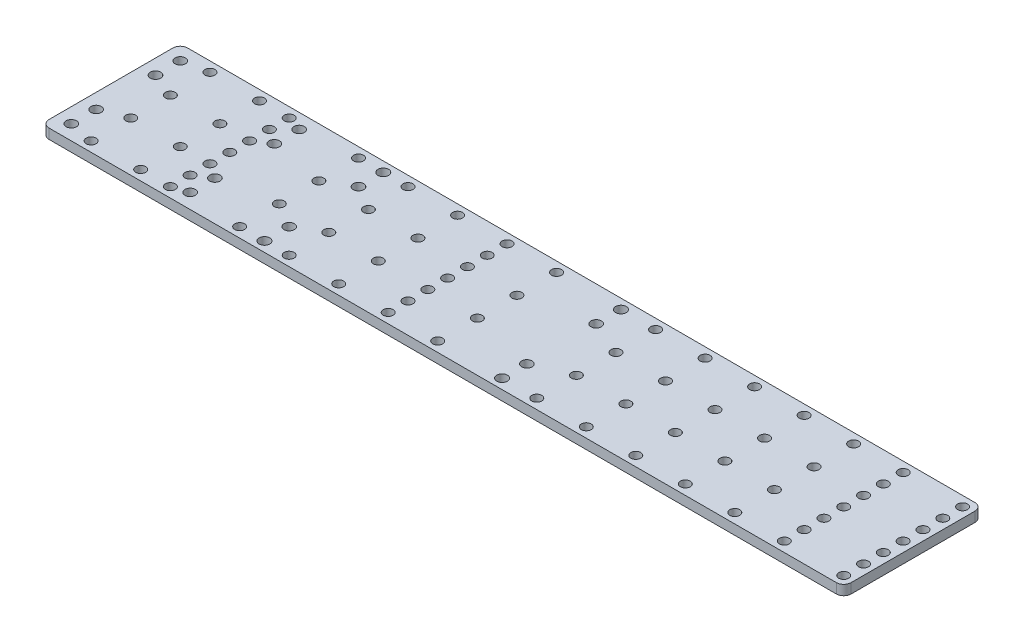
from build123d import *

# Parameters (mm, degrees)
SKETCH_1_W               = 324
SKETCH_1_H               = 56
EXTRUDE_1_DEPTH          = 4
CUT_EXTRUDE_1_DEPTH      = 10
CUT_EXTRUDE_2_DEPTH      = 329.828222633
CUT_EXTRUDE_2_DEPTH_BACK = 329.828222633
SKETCH_3_R               = 2.15
SKETCH_3_R_2             = 2.1
CUT_EXTRUDE_3_DEPTH      = 329.828222633
CUT_EXTRUDE_3_DEPTH_BACK = 329.828222633
SKETCH_4_R               = 2
FILLET_1_R               = 3


with BuildPart() as part:
    # 草图1 → 凸台-拉伸1 (new body)
    with BuildSketch(Plane(origin=(0, 0, 0), x_dir=(1, 0, 0), z_dir=(0, 1, 0))):
        with Locations((162, 28)):
            Rectangle(SKETCH_1_W, SKETCH_1_H)
    extrude(amount=EXTRUDE_1_DEPTH)

    # 草图2 → 切除-拉伸1 (cut)
    with BuildSketch(Plane(origin=(0, 4, 0), x_dir=(1, 0, 0), z_dir=(0, 1, 0))):
        with BuildLine():
            ThreePointArc((294, 44.000014101), (296, 42.000014101), (298, 44.000014101))
            ThreePointArc((298, 44.000014101), (296, 46.000014101), (294, 44.000014101))
        make_face()
        with BuildLine():
            ThreePointArc((294, 52.000014101), (296, 50.000014101), (298, 52.000014101))
            ThreePointArc((298, 52.000014101), (296, 54.000014101), (294, 52.000014101))
        make_face()
        with BuildLine():
            ThreePointArc((294, 12.000014101), (296, 10.000014101), (298, 12.000014101))
            ThreePointArc((298, 12.000014101), (296, 14.000014101), (294, 12.000014101))
        make_face()
        with BuildLine():
            ThreePointArc((294, 4.000014101), (296, 2.000014101), (298, 4.000014101))
            ThreePointArc((298, 4.000014101), (296, 6.000014101), (294, 4.000014101))
        make_face()
        with BuildLine():
            ThreePointArc((294, 20.000014101), (296, 18.000014101), (298, 20.000014101))
            ThreePointArc((298, 20.000014101), (296, 22.000014101), (294, 20.000014101))
        make_face()
        with BuildLine():
            ThreePointArc((294, 28.000014101), (296, 26.000014101), (298, 28.000014101))
            ThreePointArc((298, 28.000014101), (296, 30.000014101), (294, 28.000014101))
        make_face()
        with BuildLine():
            ThreePointArc((294, 36.000014101), (296, 34.000014101), (298, 36.000014101))
            ThreePointArc((298, 36.000014101), (296, 38.000014101), (294, 36.000014101))
        make_face()
        with BuildLine():
            ThreePointArc((134, 44.000014101), (136, 42.000014101), (138, 44.000014101))
            ThreePointArc((138, 44.000014101), (136, 46.000014101), (134, 44.000014101))
        make_face()
        with BuildLine():
            ThreePointArc((134, 52.000014101), (136, 50.000014101), (138, 52.000014101))
            ThreePointArc((138, 52.000014101), (136, 54.000014101), (134, 52.000014101))
        make_face()
        with BuildLine():
            ThreePointArc((134, 12.000014101), (136, 10.000014101), (138, 12.000014101))
            ThreePointArc((138, 12.000014101), (136, 14.000014101), (134, 12.000014101))
        make_face()
        with BuildLine():
            ThreePointArc((134, 4.000014101), (136, 2.000014101), (138, 4.000014101))
            ThreePointArc((138, 4.000014101), (136, 6.000014101), (134, 4.000014101))
        make_face()
        with BuildLine():
            ThreePointArc((134, 20.000014101), (136, 18.000014101), (138, 20.000014101))
            ThreePointArc((138, 20.000014101), (136, 22.000014101), (134, 20.000014101))
        make_face()
        with BuildLine():
            ThreePointArc((134, 28.000014101), (136, 26.000014101), (138, 28.000014101))
            ThreePointArc((138, 28.000014101), (136, 30.000014101), (134, 28.000014101))
        make_face()
        with BuildLine():
            ThreePointArc((134, 36.000014101), (136, 34.000014101), (138, 36.000014101))
            ThreePointArc((138, 36.000014101), (136, 38.000014101), (134, 36.000014101))
        make_face()
        with BuildLine():
            ThreePointArc((46, 44.000014101), (48, 42.000014101), (50, 44.000014101))
            ThreePointArc((50, 44.000014101), (48, 46.000014101), (46, 44.000014101))
        make_face()
        with BuildLine():
            ThreePointArc((46, 52.000014101), (48, 50.000014101), (50, 52.000014101))
            ThreePointArc((50, 52.000014101), (48, 54.000014101), (46, 52.000014101))
        make_face()
        with BuildLine():
            ThreePointArc((46, 12.000014101), (48, 10.000014101), (50, 12.000014101))
            ThreePointArc((50, 12.000014101), (48, 14.000014101), (46, 12.000014101))
        make_face()
        with BuildLine():
            ThreePointArc((46, 4.000014101), (48, 2.000014101), (50, 4.000014101))
            ThreePointArc((50, 4.000014101), (48, 6.000014101), (46, 4.000014101))
        make_face()
        with BuildLine():
            ThreePointArc((46, 20.000014101), (48, 18.000014101), (50, 20.000014101))
            ThreePointArc((50, 20.000014101), (48, 22.000014101), (46, 20.000014101))
        make_face()
        with BuildLine():
            ThreePointArc((46, 28.000014101), (48, 26.000014101), (50, 28.000014101))
            ThreePointArc((50, 28.000014101), (48, 30.000014101), (46, 28.000014101))
        make_face()
        with BuildLine():
            ThreePointArc((46, 36.000014101), (48, 34.000014101), (50, 36.000014101))
            ThreePointArc((50, 36.000014101), (48, 38.000014101), (46, 36.000014101))
        make_face()
    extrude(amount=-CUT_EXTRUDE_1_DEPTH, mode=Mode.SUBTRACT)

    # 草图3 → 切除-拉伸2 (cut, two sides: drawn at the far end of the back side and taken through both)
    with BuildSketch(Plane(origin=(0, 4, 0), x_dir=(1, 0, 0), z_dir=(0, 1, 0)).offset(-CUT_EXTRUDE_2_DEPTH_BACK)):
        with Locations(Location((182, 52, 0), (0, 0, 270))):
            Circle(SKETCH_3_R)
        with Locations(Location((182, 42, 0), (0, 0, 270))):
            Circle(SKETCH_3_R_2)
        with Locations(Location((182, 14, 0), (0, 0, 270))):
            Circle(SKETCH_3_R_2)
        with Locations(Location((182, 4, 0), (0, 0, 270))):
            Circle(SKETCH_3_R)
        with Locations(Location((86, 52, 0), (0, 0, 270))):
            Circle(SKETCH_3_R)
        with Locations(Location((86, 4, 0), (0, 0, 270))):
            Circle(SKETCH_3_R)
        with Locations(Location((86, 42, 0), (0, 0, 270))):
            Circle(SKETCH_3_R_2)
        with Locations(Location((86, 14, 0), (0, 0, 270))):
            Circle(SKETCH_3_R_2)
        with Locations(Location((6, 6, 0), (0, 0, 270))):
            Circle(SKETCH_3_R_2)
        with Locations(Location((6, 16, 0), (0, 0, 270))):
            Circle(SKETCH_3_R_2)
        with Locations(Location((6, 40, 0), (0, 0, 270))):
            Circle(SKETCH_3_R_2)
        with Locations(Location((6, 50, 0), (0, 0, 270))):
            Circle(SKETCH_3_R_2)
        with Locations(Location((54, 50, 0), (0, 0, 270))):
            Circle(SKETCH_3_R_2)
        with Locations(Location((54, 40, 0), (0, 0, 270))):
            Circle(SKETCH_3_R_2)
        with Locations(Location((54, 6, 0), (0, 0, 270))):
            Circle(SKETCH_3_R_2)
        with Locations(Location((54, 16, 0), (0, 0, 270))):
            Circle(SKETCH_3_R_2)
    extrude(amount=CUT_EXTRUDE_2_DEPTH + CUT_EXTRUDE_2_DEPTH_BACK, mode=Mode.SUBTRACT)

    # 草图4 → 切除-拉伸3 (cut, two sides: drawn at the far end of the back side and taken through both)
    with BuildSketch(Plane(origin=(0, 4, 0), x_dir=(1, 0, 0), z_dir=(0, 1, 0)).offset(-CUT_EXTRUDE_3_DEPTH_BACK)):
        with Locations(Location((296, 4.000014101, 0), (0, 0, 270))):
            Circle(SKETCH_4_R)
        with Locations(Location((296, 20.000014101, 0), (0, 0, 270))):
            Circle(SKETCH_4_R)
        with Locations(Location((296, 36.000014101, 0), (0, 0, 270))):
            Circle(SKETCH_4_R)
        with Locations(Location((296, 52.000014101, 0), (0, 0, 270))):
            Circle(SKETCH_4_R)
        with Locations(Location((276, 4.000014101, 0), (0, 0, 270))):
            Circle(SKETCH_4_R)
        with Locations(Location((276, 20.000014101, 0), (0, 0, 270))):
            Circle(SKETCH_4_R)
        with Locations(Location((276, 36.000014101, 0), (0, 0, 270))):
            Circle(SKETCH_4_R)
        with Locations(Location((276, 52.000014101, 0), (0, 0, 270))):
            Circle(SKETCH_4_R)
        with Locations(Location((256, 4.000014101, 0), (0, 0, 270))):
            Circle(SKETCH_4_R)
        with Locations(Location((256, 20.000014101, 0), (0, 0, 270))):
            Circle(SKETCH_4_R)
        with Locations(Location((256, 36.000014101, 0), (0, 0, 270))):
            Circle(SKETCH_4_R)
        with Locations(Location((256, 52.000014101, 0), (0, 0, 270))):
            Circle(SKETCH_4_R)
        with Locations(Location((236, 4.000014101, 0), (0, 0, 270))):
            Circle(SKETCH_4_R)
        with Locations(Location((236, 20.000014101, 0), (0, 0, 270))):
            Circle(SKETCH_4_R)
        with Locations(Location((236, 36.000014101, 0), (0, 0, 270))):
            Circle(SKETCH_4_R)
        with Locations(Location((236, 52.000014101, 0), (0, 0, 270))):
            Circle(SKETCH_4_R)
        with Locations(Location((216, 4.000014101, 0), (0, 0, 270))):
            Circle(SKETCH_4_R)
        with Locations(Location((216, 20.000014101, 0), (0, 0, 270))):
            Circle(SKETCH_4_R)
        with Locations(Location((216, 36.000014101, 0), (0, 0, 270))):
            Circle(SKETCH_4_R)
        with Locations(Location((216, 52.000014101, 0), (0, 0, 270))):
            Circle(SKETCH_4_R)
        with Locations(Location((196, 4.000014101, 0), (0, 0, 270))):
            Circle(SKETCH_4_R)
        with Locations(Location((196, 20.000014101, 0), (0, 0, 270))):
            Circle(SKETCH_4_R)
        with Locations(Location((196, 36.000014101, 0), (0, 0, 270))):
            Circle(SKETCH_4_R)
        with Locations(Location((196, 52.000014101, 0), (0, 0, 270))):
            Circle(SKETCH_4_R)
        with Locations(Location((156, 4.000014101, 0), (0, 0, 270))):
            Circle(SKETCH_4_R)
        with Locations(Location((156, 20.000014101, 0), (0, 0, 270))):
            Circle(SKETCH_4_R)
        with Locations(Location((156, 36.000014101, 0), (0, 0, 270))):
            Circle(SKETCH_4_R)
        with Locations(Location((156, 52.000014101, 0), (0, 0, 270))):
            Circle(SKETCH_4_R)
        with Locations(Location((116, 4.000014101, 0), (0, 0, 270))):
            Circle(SKETCH_4_R)
        with Locations(Location((116, 20.000014101, 0), (0, 0, 270))):
            Circle(SKETCH_4_R)
        with Locations(Location((116, 36.000014101, 0), (0, 0, 270))):
            Circle(SKETCH_4_R)
        with Locations(Location((116, 52.000014101, 0), (0, 0, 270))):
            Circle(SKETCH_4_R)
        with Locations(Location((96, 4.000014101, 0), (0, 0, 270))):
            Circle(SKETCH_4_R)
        with Locations(Location((96, 20.000014101, 0), (0, 0, 270))):
            Circle(SKETCH_4_R)
        with Locations(Location((96, 36.000014101, 0), (0, 0, 270))):
            Circle(SKETCH_4_R)
        with Locations(Location((96, 52.000014101, 0), (0, 0, 270))):
            Circle(SKETCH_4_R)
        with Locations(Location((76, 4.000014101, 0), (0, 0, 270))):
            Circle(SKETCH_4_R)
        with Locations(Location((76, 20.000014101, 0), (0, 0, 270))):
            Circle(SKETCH_4_R)
        with Locations(Location((76, 36.000014101, 0), (0, 0, 270))):
            Circle(SKETCH_4_R)
        with Locations(Location((76, 52.000014101, 0), (0, 0, 270))):
            Circle(SKETCH_4_R)
        with Locations(Location((36, 4.000014101, 0), (0, 0, 270))):
            Circle(SKETCH_4_R)
        with Locations(Location((36, 20.000014101, 0), (0, 0, 270))):
            Circle(SKETCH_4_R)
        with Locations(Location((36, 36.000014101, 0), (0, 0, 270))):
            Circle(SKETCH_4_R)
        with Locations(Location((36, 52.000014101, 0), (0, 0, 270))):
            Circle(SKETCH_4_R)
        with Locations(Location((16, 4.000014101, 0), (0, 0, 270))):
            Circle(SKETCH_4_R)
        with Locations(Location((16, 20.000014101, 0), (0, 0, 270))):
            Circle(SKETCH_4_R)
        with Locations(Location((16, 36.000014101, 0), (0, 0, 270))):
            Circle(SKETCH_4_R)
        with Locations(Location((16, 52.000014101, 0), (0, 0, 270))):
            Circle(SKETCH_4_R)
        with BuildLine():
            ThreePointArc((318, 44.000014101), (320, 42.000014101), (322, 44.000014101))
            ThreePointArc((322, 44.000014101), (320, 46.000014101), (318, 44.000014101))
        make_face()
        with BuildLine():
            ThreePointArc((318, 52.000014101), (320, 50.000014101), (322, 52.000014101))
            ThreePointArc((322, 52.000014101), (320, 54.000014101), (318, 52.000014101))
        make_face()
        with BuildLine():
            ThreePointArc((318, 12.000014101), (320, 10.000014101), (322, 12.000014101))
            ThreePointArc((322, 12.000014101), (320, 14.000014101), (318, 12.000014101))
        make_face()
        with BuildLine():
            ThreePointArc((318, 4.000014101), (320, 2.000014101), (322, 4.000014101))
            ThreePointArc((322, 4.000014101), (320, 6.000014101), (318, 4.000014101))
        make_face()
        with BuildLine():
            ThreePointArc((318, 20.000014101), (320, 18.000014101), (322, 20.000014101))
            ThreePointArc((322, 20.000014101), (320, 22.000014101), (318, 20.000014101))
        make_face()
        with BuildLine():
            ThreePointArc((318, 28.000014101), (320, 26.000014101), (322, 28.000014101))
            ThreePointArc((322, 28.000014101), (320, 30.000014101), (318, 28.000014101))
        make_face()
        with BuildLine():
            ThreePointArc((318, 36.000014101), (320, 34.000014101), (322, 36.000014101))
            ThreePointArc((322, 36.000014101), (320, 38.000014101), (318, 36.000014101))
        make_face()
    extrude(amount=CUT_EXTRUDE_3_DEPTH + CUT_EXTRUDE_3_DEPTH_BACK, mode=Mode.SUBTRACT)

    # 圆角1
    fillet_1_edges = [part.edges().sort_by_distance(p)[0] for p in [
        (0, 2, -56),
        (324, 2, -56),
        (324, 2, 0),
        (0, 2, 0),
    ]]
    fillet(fillet_1_edges, radius=FILLET_1_R)


solid = part.part
